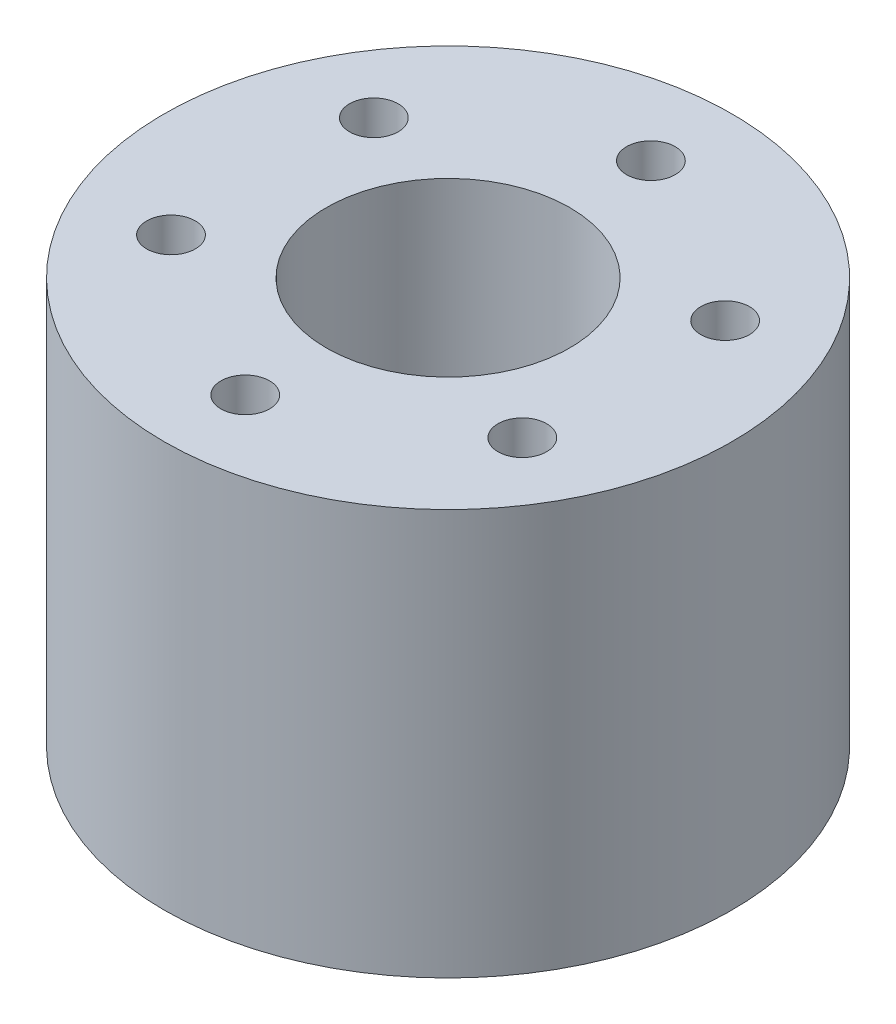
from build123d import *

# Parameters (mm, degrees)
SKETCH1_R           = 17.5
SKETCH1_R_2         = 1.5
SKETCH1_R_3         = 7.5
BOSS_EXTRUDE1_DEPTH = 25


with BuildPart() as part:
    # Sketch1 → Boss-Extrude1 (new body)
    with BuildSketch(Plane(origin=(0, 0, 0), x_dir=(1, 0, 0), z_dir=(0, 1, 0))):
        with Locations(Location((0, 0, 0), (0, 0, 270))):
            Circle(SKETCH1_R)
        with Locations(Location((0, 12.5, 0), (0, 0, 270))):
            Circle(SKETCH1_R_2, mode=Mode.SUBTRACT)
        with Locations(Location((10.825317547, 6.25, 0), (0, 0, 270))):
            Circle(SKETCH1_R_2, mode=Mode.SUBTRACT)
        with Locations(Location((10.825317547, -6.25, 0), (0, 0, 270))):
            Circle(SKETCH1_R_2, mode=Mode.SUBTRACT)
        with Locations(Location((0, -12.5, 0), (0, 0, 270))):
            Circle(SKETCH1_R_2, mode=Mode.SUBTRACT)
        with Locations(Location((-10.825317547, -6.25, 0), (0, 0, 270))):
            Circle(SKETCH1_R_2, mode=Mode.SUBTRACT)
        with Locations(Location((-10.825317547, 6.25, 0), (0, 0, 270))):
            Circle(SKETCH1_R_2, mode=Mode.SUBTRACT)
        with Locations(Location((0, 0, 0), (0, 0, 270))):
            Circle(SKETCH1_R_3, mode=Mode.SUBTRACT)
    extrude(amount=BOSS_EXTRUDE1_DEPTH)


solid = part.part
